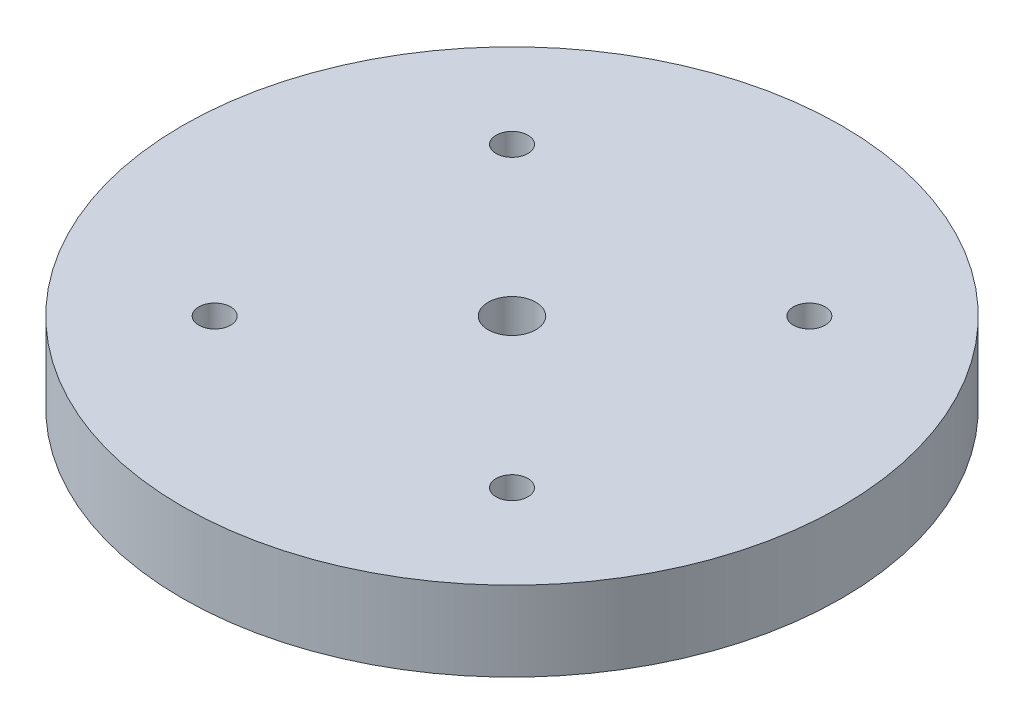
from build123d import *

# Parameters (mm, degrees)
SKETCH1_R               = 12.419595949
SKETCH1_R_2             = 0.9
SKETCH1_R_3             = 0.6
DISCO_APONEUROSIS_DEPTH = 3


with BuildPart() as part:
    # Sketch1 → Disco_aponeurosis (new body)
    with BuildSketch(Plane(origin=(0, -209, 0), x_dir=(1, 0, 0), z_dir=(0, 1, 0))):
        with Locations(Location((0, 0, 0), (0, 0, 270))):
            Circle(SKETCH1_R)
        with Locations(Location((0, 0, 0), (0, 0, 270))):
            Circle(SKETCH1_R_2, mode=Mode.SUBTRACT)
        with Locations(Location((5.6, 5.6, 0), (0, 0, 270))):
            Circle(SKETCH1_R_3, mode=Mode.SUBTRACT)
        with Locations(Location((-5.6, 5.6, 0), (0, 0, 270))):
            Circle(SKETCH1_R_3, mode=Mode.SUBTRACT)
        with Locations(Location((-5.6, -5.6, 0), (0, 0, 270))):
            Circle(SKETCH1_R_3, mode=Mode.SUBTRACT)
        with Locations(Location((5.6, -5.6, 0), (0, 0, 270))):
            Circle(SKETCH1_R_3, mode=Mode.SUBTRACT)
    extrude(amount=DISCO_APONEUROSIS_DEPTH)

    # Sketch2 → Boca_tendon (revolve)
    with BuildSketch(Plane.XY, mode=Mode.PRIVATE) as boca_tendon_sk:
        Polygon((0, -209), (3, -209), (3, -215), (1.2, -215), (0, -215), align=None)
    revolve(boca_tendon_sk.sketch.rotate(Axis((0, -219, 0), (0, 1, 0)), 90), axis=Axis((0, -219, 0), (0, 1, 0)))


solid = part.part
